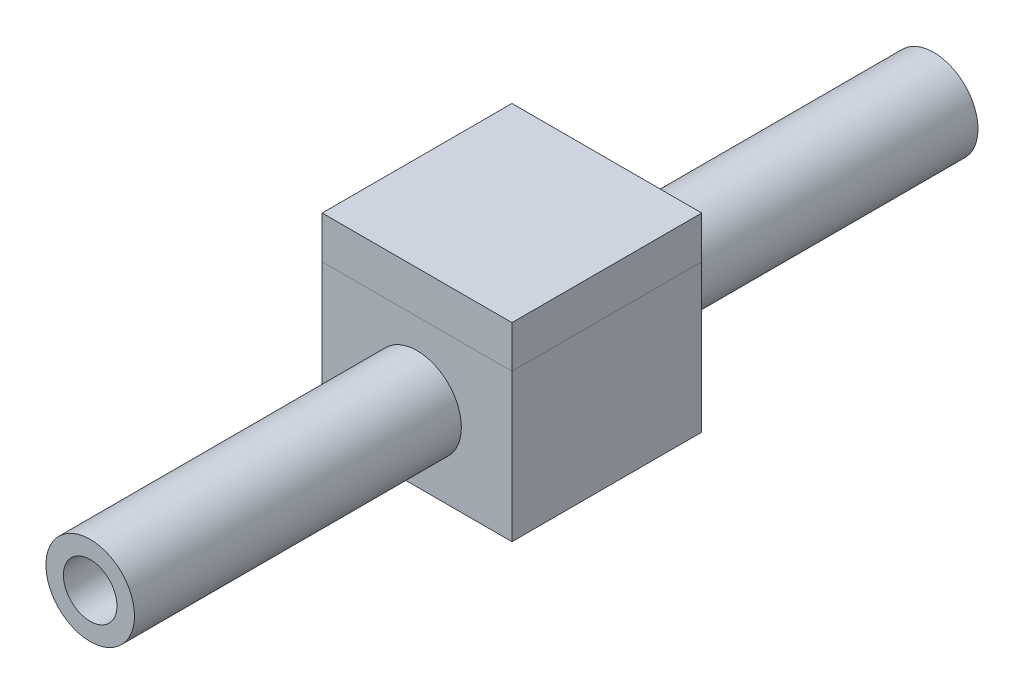
from build123d import *

# Parameters (mm, degrees)
SKETCH2_W           = 45
SKETCH2_H           = 35
BOSS_EXTRUDE1_DEPTH = 45
SKETCH2_4_W         = 45
SKETCH2_4_H         = 10
BOSS_EXTRUDE3_DEPTH = 45
SKETCH3_R           = 6.35
CUT_EXTRUDE2_DEPTH  = 45
SKETCH5_R           = 10.5
BOSS_EXTRUDE4_DEPTH = 77.5
CUT_EXTRUDE4_START  = 77.5
SKETCH7_R           = 6.35
CUT_EXTRUDE4_DEPTH  = 77.5
BOSS_EXTRUDE5_START = 77.5
SKETCH8_R           = 10.5
BOSS_EXTRUDE5_DEPTH = 77.5
CUT_EXTRUDE5_START  = -77.5
SKETCH9_R           = 6.35
CUT_EXTRUDE5_DEPTH  = 77.5


with BuildPart() as part:
    # Sketch2 → Boss-Extrude1 (new body)
    with BuildSketch(Plane.XY):
        Rectangle(SKETCH2_W, SKETCH2_H)
    extrude(amount=BOSS_EXTRUDE1_DEPTH)

    # Sketch3 → Cut-Extrude2 (cut)
    with BuildSketch(Plane.XY):
        with Locations(Location((0, 0, 0), (0, 0, 180))):
            Circle(SKETCH3_R)
    extrude(amount=CUT_EXTRUDE2_DEPTH, mode=Mode.SUBTRACT)

    # Sketch5 → Boss-Extrude4 (add)
    with BuildSketch(Plane.XY):
        Circle(SKETCH5_R)
    extrude(amount=-BOSS_EXTRUDE4_DEPTH)

    # Sketch7 → Cut-Extrude4 (cut)
    with BuildSketch(Plane(origin=(0, 0, 0), x_dir=(-1, 0, 0), z_dir=(0, 0, -1)).offset(CUT_EXTRUDE4_START)):
        Circle(SKETCH7_R)
    extrude(amount=-CUT_EXTRUDE4_DEPTH, mode=Mode.SUBTRACT)

    # Sketch8 → Boss-Extrude5 (add)
    with BuildSketch(Plane.XY.offset(45).offset(BOSS_EXTRUDE5_START)):
        Circle(SKETCH8_R)
    extrude(amount=-BOSS_EXTRUDE5_DEPTH)

    # Sketch9 → Cut-Extrude5 (cut)
    with BuildSketch(Plane.XY.offset(122.5).offset(CUT_EXTRUDE5_START)):
        with Locations(Location((0, 0, 0), (0, 0, 180))):
            Circle(SKETCH9_R)
    extrude(amount=CUT_EXTRUDE5_DEPTH, mode=Mode.SUBTRACT)


with BuildPart() as body_2:
    # Sketch2<4> → Boss-Extrude3 (new body)
    with BuildSketch(Plane.XY):
        with Locations((0, 22.5)):
            Rectangle(SKETCH2_4_W, SKETCH2_4_H)
    extrude(amount=BOSS_EXTRUDE3_DEPTH)


solid = Compound([part.part, body_2.part])
